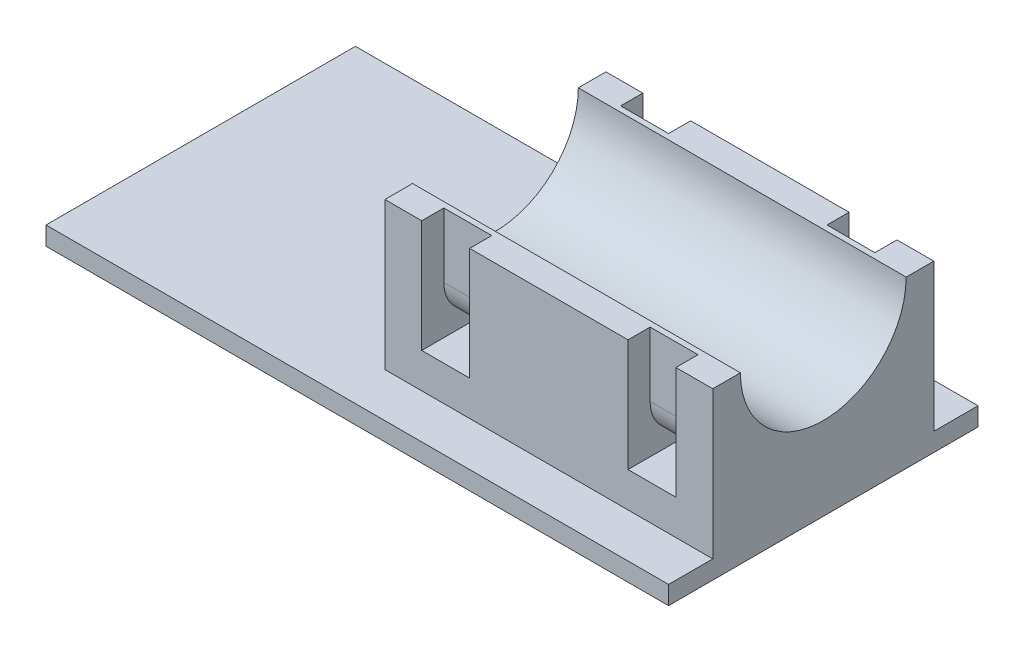
from build123d import *

# Parameters (mm, degrees)
SKETCH1_W            = 169
SKETCH1_H            = 84
BOSS_EXTRUDE1_DEPTH  = 5
SKETCH2_W            = 89
SKETCH2_H            = 60
BOSS_EXTRUDE2_DEPTH  = 40
CUT_EXTRUDE1_DEPTH   = 109.212753407
SKETCH4_W            = 13
SKETCH4_H            = 3
CUT_EXTRUDE2_DEPTH   = 120.788355027
SKETCH6_W            = 13
SKETCH6_H            = 27.5
CUT_EXTRUDE5_DEPTH   = 6
FILLET1_R            = 10
FILLET1_OF_MIRROR1_R = 10


with BuildPart() as part:
    # Sketch1 → Boss-Extrude1 (new body)
    with BuildSketch(Plane(origin=(0, 0, 0), x_dir=(1, 0, 0), z_dir=(0, 1, 0))):
        Rectangle(SKETCH1_W, SKETCH1_H)
    extrude(amount=BOSS_EXTRUDE1_DEPTH)

    # Sketch2 → Boss-Extrude2 (add)
    with BuildSketch(Plane(origin=(0, 5, 0), x_dir=(1, 0, 0), z_dir=(0, 1, 0))):
        with Locations((40, 0)):
            Rectangle(SKETCH2_W, SKETCH2_H)
    extrude(amount=BOSS_EXTRUDE2_DEPTH)

    # Sketch3 → Cut-Extrude1 (cut, through all)
    with BuildSketch(Plane.ZY.offset(4.5)):
        with BuildLine():
            Line((-22.5, 45), (22.5, 45))
            ThreePointArc((22.5, 45), (0, 22.5), (-22.5, 45))
        make_face()
    extrude(amount=-CUT_EXTRUDE1_DEPTH, mode=Mode.SUBTRACT)

    # Sketch4 → Cut-Extrude2 (cut, through all)
    with BuildSketch(Plane(origin=(0, 0, -30), x_dir=(-1, 0, 0), z_dir=(0, 0, -1))):
        with Locations((-12, 16)):
            Rectangle(SKETCH4_W, SKETCH4_H)
        with Locations((-68, 16)):
            Rectangle(SKETCH4_W, SKETCH4_H)
    extrude(amount=-CUT_EXTRUDE2_DEPTH, mode=Mode.SUBTRACT)

    # Sketch6 → Cut-Extrude5 (cut)
    with BuildSketch(Plane.XY.offset(30)):
        with Locations((12, 31.25)):
            Rectangle(SKETCH6_W, SKETCH6_H)
        with Locations((68, 31.25)):
            Rectangle(SKETCH6_W, SKETCH6_H)
    cut_extrude5 = extrude(amount=-CUT_EXTRUDE5_DEPTH, mode=Mode.SUBTRACT)

    # Fillet1
    fillet1_edges = [part.edges().sort_by_distance(p)[0] for p in [
        (12, 17.5, 24),
        (68, 17.5, 24),
    ]]
    fillet(fillet1_edges, radius=FILLET1_R)

    # Mirror1: Cut-Extrude5 across plane
    add(cut_extrude5.mirror(Plane.XY), mode=Mode.SUBTRACT)

    # Fillet1 of Mirror1
    fillet1_of_mirror1_edges = [part.edges().sort_by_distance(p)[0] for p in [
        (12, 17.5, -24),
        (68, 17.5, -24),
    ]]
    fillet(fillet1_of_mirror1_edges, radius=FILLET1_OF_MIRROR1_R)


solid = part.part
